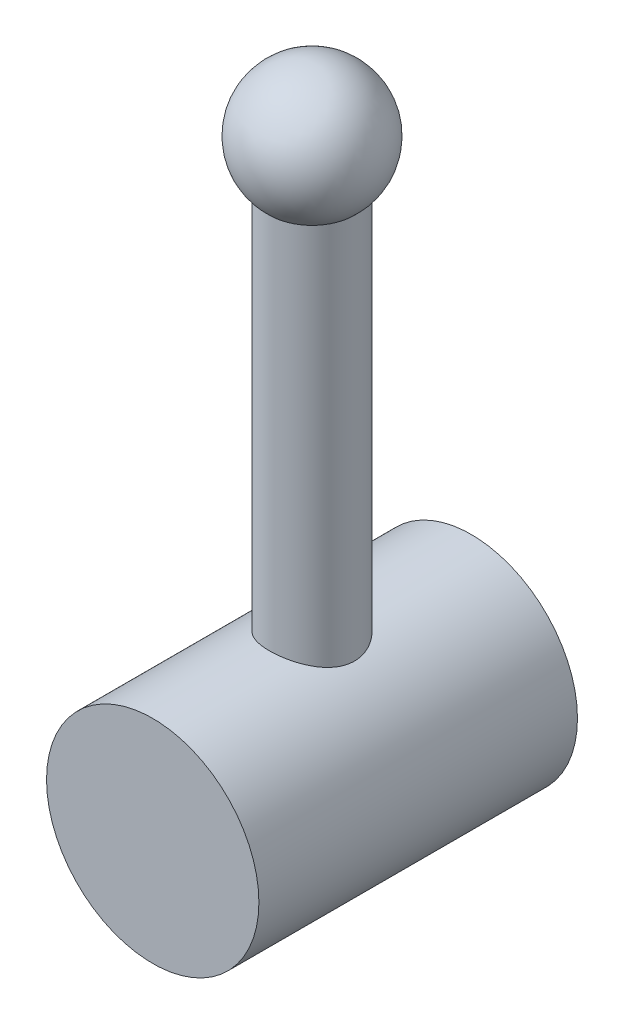
from build123d import *

# Parameters (mm, degrees)
SKETCH_1_R      = 10
EXTRUDE_2_DEPTH = 30
SKETCH_2_R      = 4
EXTRUDE_3_DEPTH = 50


with BuildPart() as part:
    # 草图1 → 凸台-拉伸2 (new body)
    with BuildSketch(Plane.XY):
        Circle(SKETCH_1_R)
    extrude(amount=EXTRUDE_2_DEPTH)

    # 草图2 → 凸台-拉伸3 (add)
    with BuildSketch(Plane(origin=(0, 0, 0), x_dir=(1, 0, 0), z_dir=(0, 1, 0))):
        with Locations(Location((0, -15, 0), (0, 0, 90))):
            Circle(SKETCH_2_R)
    extrude(amount=EXTRUDE_3_DEPTH)

    # 草图3 → 旋转1 (revolve)
    with BuildSketch(Plane(origin=(0, 50, 0), x_dir=(1, 0, 0), z_dir=(0, 1, 0))):
        with BuildLine():
            Line((0, -9), (0, -21))
            ThreePointArc((0, -21), (6, -15), (0, -9))
        make_face()
    revolve(axis=Axis((0, 50, 9), (0, 0, 1)))


solid = part.part
